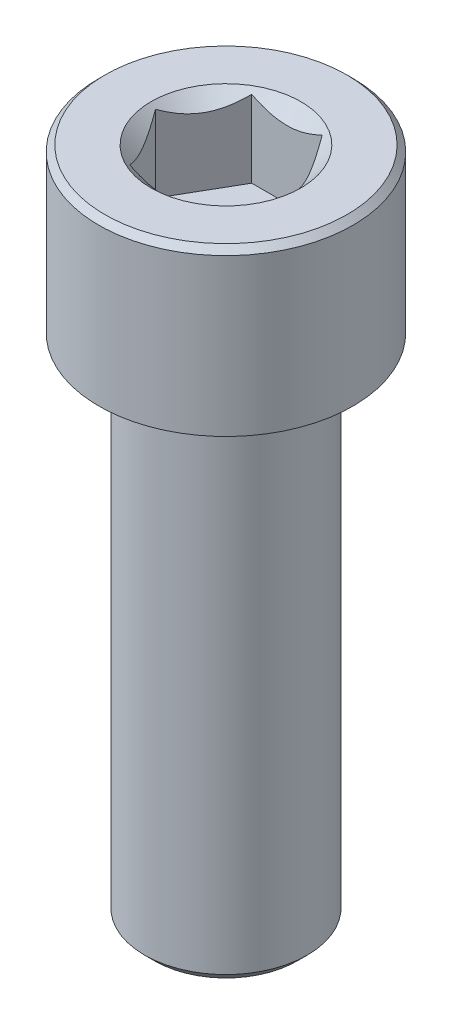
from build123d import *

# Parameters (mm, degrees)
WYCI_GNI_CIE1_DEPTH        = 4
SFAZOWANIE1_SIZE           = 0.3
SZKIC3_R                   = 3.68172134
WYTNIJ_WYCI_GNI_CIE1_DEPTH = 2
WYTNIJ_WYCI_GNI_CIE1_DRAFT = -45
SFAZOWANIE2_SIZE           = 0.5


with BuildPart() as part:
    # Szkic1 → Obrót1 (revolve)
    with BuildSketch(Plane.XY, mode=Mode.PRIVATE) as obr_t1_sk:
        Polygon((0, 0), (-4, 0), (-4, 25), (-6.25, 25), (-6.25, 33), (0, 33), align=None)
    revolve(obr_t1_sk.sketch.rotate(Axis((0, 0, 0), (0, 1, 0)), 270), axis=Axis((0, 0, 0), (0, 1, 0)))

    # Szkic2 → Wyciągnięcie1 (cut)
    with BuildSketch(Plane(origin=(0, 33, 0), x_dir=(1, 0, 0), z_dir=(0, 1, 0))):
        Polygon((3.464101615, 0), (1.732050808, 3), (-1.732050808, 3), (-3.464101615, 0), (-1.732050808, -3), (1.732050808, -3), align=None)
    extrude(amount=-WYCI_GNI_CIE1_DEPTH, mode=Mode.SUBTRACT)

    # Sfazowanie1
    sfazowanie1_edges = [part.edges().sort_by_distance(p)[0] for p in [
        (0, 33, 6.25),
    ]]
    chamfer(sfazowanie1_edges, length=SFAZOWANIE1_SIZE)


with BuildPart() as wytnij_wyci_gni_cie1_tool:
    # Szkic3 → Wytnij-wyciągnięcie1 (with draft: the straight prism first)
    with BuildSketch(Plane(origin=(0, 33, 0), x_dir=(1, 0, 0), z_dir=(0, 1, 0))):
        Circle(SZKIC3_R)
    extrude(amount=-WYTNIJ_WYCI_GNI_CIE1_DEPTH)
    # Wytnij-wyciągnięcie1: the draft: its side faces are tilted about the plane it starts from
    wytnij_wyci_gni_cie1_sides = [wytnij_wyci_gni_cie1_tool.faces().sort_by_distance(p)[0] for p in [
        (-3.68172134, 32, 0),
    ]]
    draft(wytnij_wyci_gni_cie1_sides, Plane(origin=(0, 33, 0), x_dir=(1, 0, 0), z_dir=(0, 1, 0)), WYTNIJ_WYCI_GNI_CIE1_DRAFT)


with BuildPart() as part_1:
    add(part.part)

    # Wytnij-wyciągnięcie1: cut by wytnij_wyci_gni_cie1_tool
    add(wytnij_wyci_gni_cie1_tool.part, mode=Mode.SUBTRACT)

    # Sfazowanie2
    sfazowanie2_edges = [part_1.edges().sort_by_distance(p)[0] for p in [
        (0, 0, 4),
    ]]
    chamfer(sfazowanie2_edges, length=SFAZOWANIE2_SIZE)


solid = part_1.part
